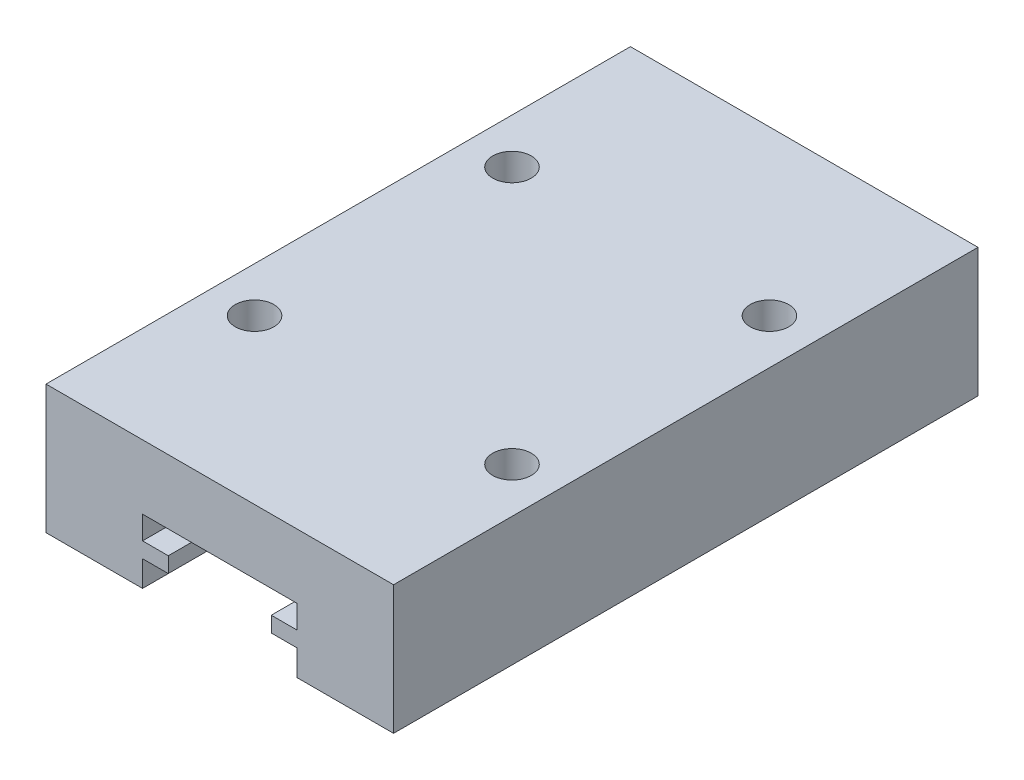
from build123d import *

# Parameters (mm, degrees)
BOSS_EXTRU_1_DEPTH      = 45.4
ESQUISSE2_R             = 1.5
ENL_V_MAT_EXTRU_1_DEPTH = 3.5


with BuildPart() as part:
    # Esquisse1 → Boss.-Extru.1 (new body)
    with BuildSketch(Plane.XY):
        Polygon((-22.795509579, 10), (4.204490421, 10), (4.204490421, 0), (-3.295509579, 0), (-3.295509579, 2), (-5.295509579, 2), (-5.295509579, 3.2), (-3.295509579, 3.2), (-3.295509579, 5), (-15.295509579, 5), (-15.295509579, 3.2), (-13.295509579, 3.2), (-13.295509579, 2), (-15.295509579, 2), (-15.295509579, 0), (-22.795509579, 0), align=None)
    extrude(amount=BOSS_EXTRU_1_DEPTH)

    # Esquisse2 → Enlèv. mat.-Extru.1 (cut)
    with BuildSketch(Plane(origin=(0, 10, 0), x_dir=(1, 0, 0), z_dir=(0, 1, 0))):
        with Locations(Location((-19.295509579, -32.7, 0), (0, 0, 270))):
            Circle(ESQUISSE2_R)
        with Locations(Location((-19.295509579, -12.7, 0), (0, 0, 270))):
            Circle(ESQUISSE2_R)
        with Locations(Location((0.704490421, -12.7, 0), (0, 0, 270))):
            Circle(ESQUISSE2_R)
        with Locations(Location((0.704490421, -32.7, 0), (0, 0, 270))):
            Circle(ESQUISSE2_R)
    extrude(amount=-ENL_V_MAT_EXTRU_1_DEPTH, mode=Mode.SUBTRACT)


solid = part.part
